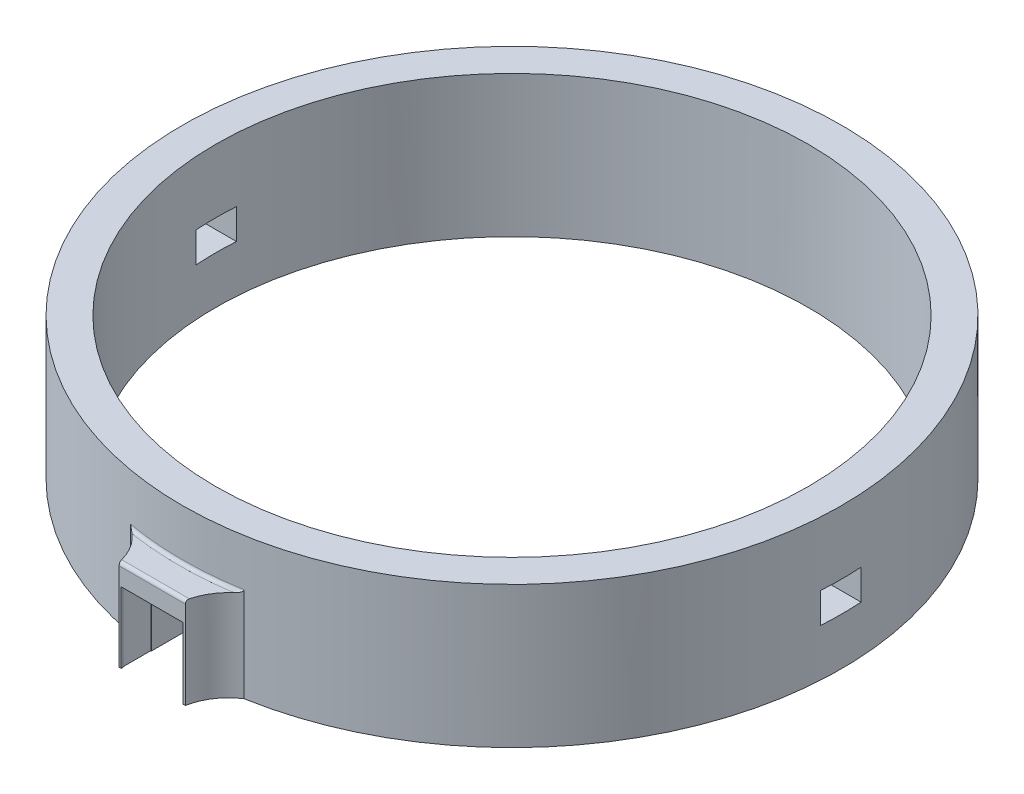
from build123d import *

# Parameters (mm, degrees)
SKETCH1_R               = 9945.749426531
BOSS_EXTRUDE1_DEPTH     = 4267.2
SKETCH2_R               = 8945.749426531
CUT_EXTRUDE1_DEPTH      = 4267.2
SKETCH4_W               = 2000
SKETCH4_H               = 2750
BOSS_EXTRUDE2_DEPTH     = 914.4
SKETCH5_W               = 1870
SKETCH5_H               = 2135
CUT_EXTRUDE2_DEPTH      = 2500
SKETCH6_W               = 864.4
SKETCH6_H               = 2222.798404513
CUT_EXTRUDE3_DEPTH      = 16.77
SKETCH7_W               = 1886.77
SKETCH7_H               = 768.69921335
CUT_EXTRUDE4_DEPTH      = 16.77
BOSS_EXTRUDE3_REACH     = 15333.985
SKETCH9_W               = 1861.615
SKETCH9_H               = 2276.741712896
CUT_EXTRUDE5_DEPTH      = 4000
CUT_EXTRUDE6_DEPTH      = 15332.985294212
CUT_EXTRUDE6_DEPTH_BACK = 15332.985294212
SKETCH10_W              = 1219.2
SKETCH10_H              = 914.4
FILLET1_R               = 100


with BuildPart() as part:
    # Sketch1 → Boss-Extrude1 (new body)
    with BuildSketch(Plane(origin=(0, 0, 0), x_dir=(1, 0, 0), z_dir=(0, 1, 0))):
        with Locations(Location((0, 0, 0), (0, 0, 270))):
            Circle(SKETCH1_R)
    extrude(amount=BOSS_EXTRUDE1_DEPTH)

    # Sketch2 → Cut-Extrude1 (cut)
    with BuildSketch(Plane(origin=(0, 4267.2, 0), x_dir=(1, 0, 0), z_dir=(0, 1, 0))):
        with Locations(Location((0, 0, 0), (0, 0, 270))):
            Circle(SKETCH2_R)
    extrude(amount=-CUT_EXTRUDE1_DEPTH, mode=Mode.SUBTRACT)


with BuildPart() as body_2:
    # Sketch4 → Boss-Extrude2 (new body)
    with BuildSketch(Plane.XY.offset(9945.749426531)):
        with Locations((0, 1375)):
            Rectangle(SKETCH4_W, SKETCH4_H)
    extrude(amount=BOSS_EXTRUDE2_DEPTH)


with BuildPart() as cut_extrude2_tool:
    # Sketch5 → Cut-Extrude2 (new, symmetric)
    with BuildSketch(Plane.XY.offset(10860.149426531)):
        with Locations((0, 1067.5)):
            Rectangle(SKETCH5_W, SKETCH5_H)
    extrude(amount=CUT_EXTRUDE2_DEPTH, both=True)


with BuildPart() as part_1:
    add(part.part)

    # Cut-Extrude2: cut by cut_extrude2_tool
    add(cut_extrude2_tool.part, mode=Mode.SUBTRACT)


with BuildPart() as body_2_1:
    add(body_2.part)

    # Cut-Extrude2: cut by cut_extrude2_tool
    add(cut_extrude2_tool.part, mode=Mode.SUBTRACT)

    # Sketch6 → Cut-Extrude3 (cut)
    with BuildSketch(Plane(origin=(-935, 0, 0), x_dir=(0, 0, -1), z_dir=(1, 0, 0))):
        with Locations((-10377.949426531, 1035.912288571)):
            Rectangle(SKETCH6_W, SKETCH6_H)
    cut_extrude3 = extrude(amount=-CUT_EXTRUDE3_DEPTH, mode=Mode.SUBTRACT)

    # Mirror1: Cut-Extrude3 across plane
    add(cut_extrude3.mirror(Plane(origin=(0, 0, 0), x_dir=(0, 0, 1), z_dir=(1, 0, 0))), mode=Mode.SUBTRACT)

    # Sketch7 → Cut-Extrude4 (cut)
    with BuildSketch(Plane.XZ.offset(-2135)):
        with Locations((0, 10425.799819856)):
            Rectangle(SKETCH7_W, SKETCH7_H)
    extrude(amount=-CUT_EXTRUDE4_DEPTH, mode=Mode.SUBTRACT)

    # Boss-Extrude3: up to this face of the body (flat: up to its plane)
    boss_extrude3_end = Plane(body_2_1.part.faces().sort_by_distance((0, 2750, 10402.949426531))[0])
    # Sketch8 → Boss-Extrude3 (add, up to the picked face)
    with BuildSketch(Plane(origin=(0, 0, 0), x_dir=(1, 0, 0), z_dir=(0, 1, 0)), mode=Mode.PRIVATE) as boss_extrude3_sk1:
        with BuildLine():
            Line((-1000, -9945.749426531), (-1000, -10860.149426531))
            ThreePointArc((-1000, -10860.149426531), (-1247.653940118, -10257.288387991), (-1709.757794535, -9797.686458515))
            ThreePointArc((-1709.757794535, -9797.686458515), (-1355.758576896, -9852.910754519), (-1000, -9895.348991084))
            Line((-1000, -9895.348991084), (1000, -9895.348991084))
            ThreePointArc((1000, -9895.348991084), (1355.758576896, -9852.910754519), (1709.757794535, -9797.686458515))
            ThreePointArc((1709.757794535, -9797.686458515), (1247.653940118, -10257.288387991), (1000, -10860.149426531))
            Line((1000, -10860.149426531), (1000, -9945.749426531))
            Line((1000, -9945.749426531), (-1000, -9945.749426531))
        make_face()
    boss_extrude3_tool1 = split(extrude(boss_extrude3_sk1.sketch, amount=BOSS_EXTRUDE3_REACH, mode=Mode.PRIVATE), bisect_by=boss_extrude3_end, keep=Keep.BOTH, mode=Mode.PRIVATE)

    add(part_1.part)  # Boss-Extrude3 merges part
    add(boss_extrude3_tool1.solids().sort_by(Axis((1035.807701, 0, 10402.949427), (0, 1, 0)))[0])

    # Sketch9 → Cut-Extrude5 (cut)
    with BuildSketch(Plane.XY.offset(9945.749426531)):
        with Locations((-4.1925, 996.629143552)):
            Rectangle(SKETCH9_W, SKETCH9_H)
    extrude(amount=-CUT_EXTRUDE5_DEPTH, mode=Mode.SUBTRACT)

    # Sketch10 → Cut-Extrude6 (cut, two sides: drawn at the far end of the back side and taken through both)
    with BuildSketch(Plane(origin=(0, 0, 0), x_dir=(0, 0, -1), z_dir=(1, 0, 0)).offset(-CUT_EXTRUDE6_DEPTH_BACK)):
        with Locations((0, 1887.367931643)):
            Rectangle(SKETCH10_W, SKETCH10_H)
    extrude(amount=CUT_EXTRUDE6_DEPTH + CUT_EXTRUDE6_DEPTH_BACK, mode=Mode.SUBTRACT)

    # Fillet1
    fillet1_edges = [body_2_1.edges().sort_by_distance(p)[0] for p in [
        (858.078428593, 2750, 9908.664545019),
        (0, 2750, 10860.149426531),
    ]]
    fillet(fillet1_edges, radius=FILLET1_R)


solid = body_2_1.part
